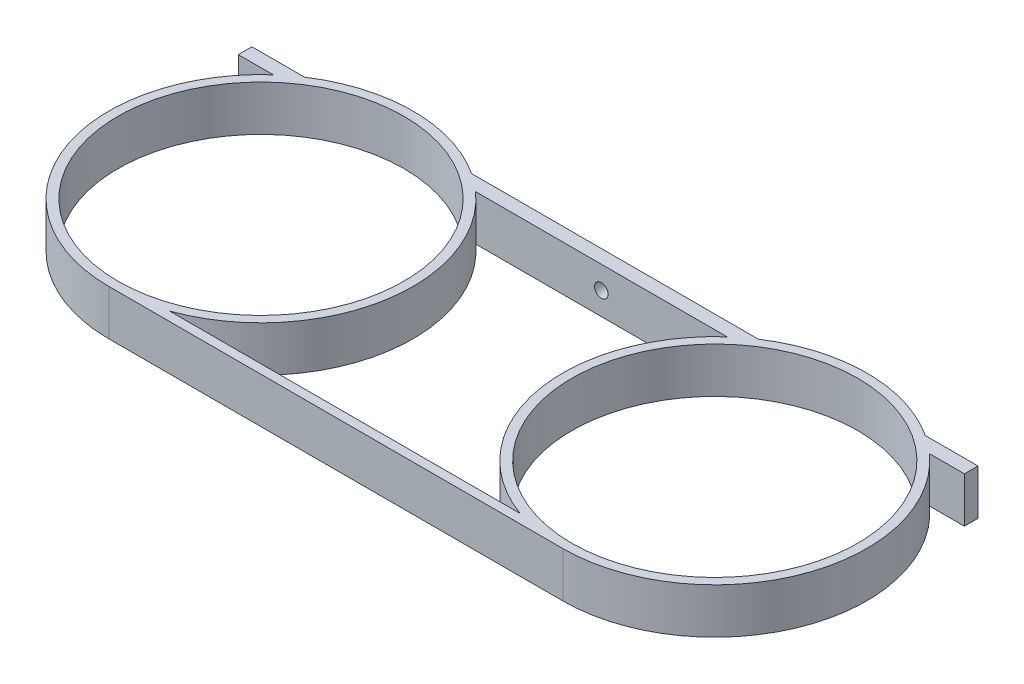
from build123d import *

# Parameters (mm, degrees)
SKETCH3_R           = 31.5
BOSS_EXTRUDE5_DEPTH = 10
SKETCH4_R           = 1.5
CUT_EXTRUDE1_DEPTH  = 22


with BuildPart() as part:
    # Sketch3 → Boss-Extrude5 (new body)
    with BuildSketch(Plane(origin=(0, 0, 0), x_dir=(1, 0, 0), z_dir=(0, 1, 0))):
        with BuildLine():
            Line((-30, 28), (-18.391574158, 28))
            ThreePointArc((-18.391574158, 28), (0, 33.5), (18.391574158, 28))
            Line((18.391574158, 28), (81.608425842, 28))
            ThreePointArc((81.608425842, 28), (100, 33.5), (118.391574158, 28))
            Line((118.391574158, 28), (130, 28))
            Line((130, 28), (130, 25))
            Line((130, 25), (122.299103121, 25))
            ThreePointArc((122.299103121, 25), (131.302955132, -11.932099564), (100, -33.5))
            Line((100, -33.5), (0, -33.5))
            ThreePointArc((0, -33.5), (-31.302955132, -11.932099564), (-22.299103121, 25))
            Line((-22.299103121, 25), (-30, 25))
            Line((-30, 25), (-30, 28))
        make_face()
        with Locations(Location((0, 0, 0), (0, 0, 270))):
            Circle(SKETCH3_R, mode=Mode.SUBTRACT)
        with Locations(Location((100, 0, 0), (0, 0, 270))):
            Circle(SKETCH3_R, mode=Mode.SUBTRACT)
        with BuildLine():
            Line((22.299103121, 25), (77.700896879, 25))
            ThreePointArc((77.700896879, 25), (67.106240001, -6.34433236), (88.598245749, -31.5))
            Line((88.598245749, -31.5), (11.401754251, -31.5))
            ThreePointArc((11.401754251, -31.5), (32.893759999, -6.34433236), (22.299103121, 25))
        make_face(mode=Mode.SUBTRACT)
    extrude(amount=BOSS_EXTRUDE5_DEPTH)

    # Sketch4 → Cut-Extrude1 (cut)
    with BuildSketch(Plane(origin=(0, 0, -28), x_dir=(-1, 0, 0), z_dir=(0, 0, -1))):
        with Locations((-50, 5)):
            Circle(SKETCH4_R)
    extrude(amount=-CUT_EXTRUDE1_DEPTH, mode=Mode.SUBTRACT)


solid = part.part
